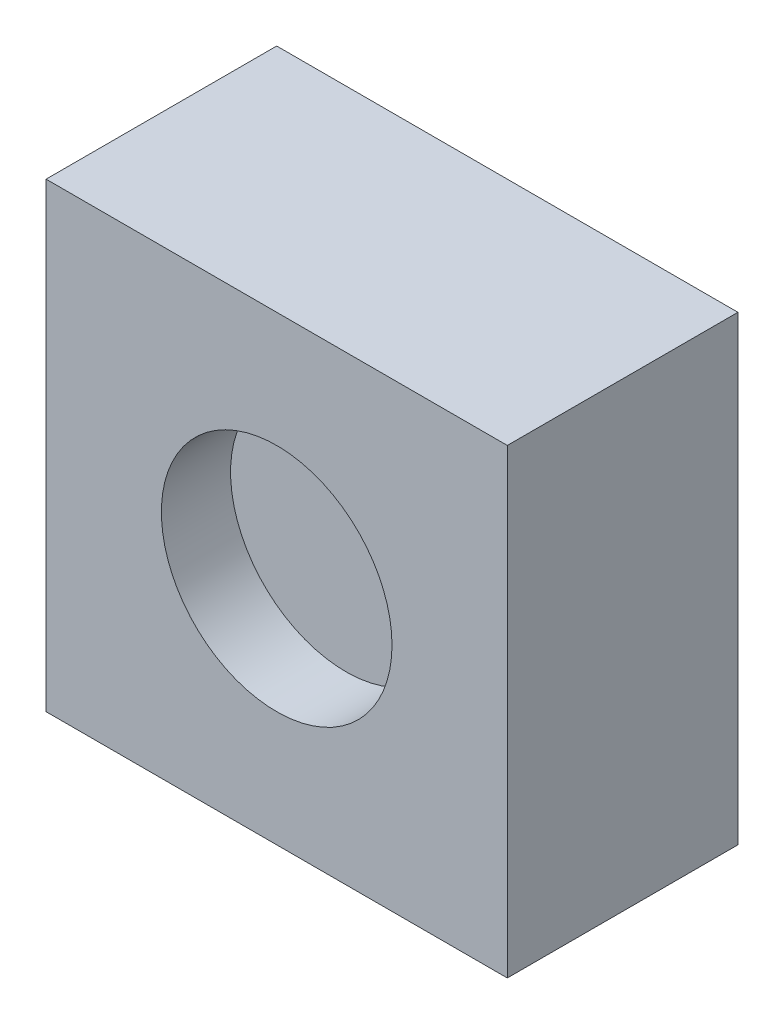
from build123d import *

# Parameters (mm, degrees)
SKETCH1_W           = 20
SKETCH1_H           = 20
BOSS_EXTRUDE1_DEPTH = 10
SKETCH2_R           = 5
CUT_EXTRUDE1_DEPTH  = 3
SKETCH3_R           = 2
CUT_EXTRUDE2_DEPTH  = 3


with BuildPart() as part:
    # Sketch1 → Boss-Extrude1 (new body)
    with BuildSketch(Plane.XY):
        with Locations((10, 10)):
            Rectangle(SKETCH1_W, SKETCH1_H)
    extrude(amount=BOSS_EXTRUDE1_DEPTH)

    # Sketch2 → Cut-Extrude1 (cut)
    with BuildSketch(Plane.XY.offset(10)):
        with Locations((10, 10)):
            Circle(SKETCH2_R)
    extrude(amount=-CUT_EXTRUDE1_DEPTH, mode=Mode.SUBTRACT)

    # Sketch3 → Cut-Extrude2 (cut)
    with BuildSketch(Plane(origin=(0, 0, 0), x_dir=(-1, 0, 0), z_dir=(0, 0, -1))):
        with Locations((-13.9, 13.9)):
            Circle(SKETCH3_R)
        with Locations((-6.1, 13.9)):
            Circle(SKETCH3_R)
        with Locations((-13.9, 6.1)):
            Circle(SKETCH3_R)
        with Locations((-6.1, 6.1)):
            Circle(SKETCH3_R)
    extrude(amount=-CUT_EXTRUDE2_DEPTH, mode=Mode.SUBTRACT)


solid = part.part
